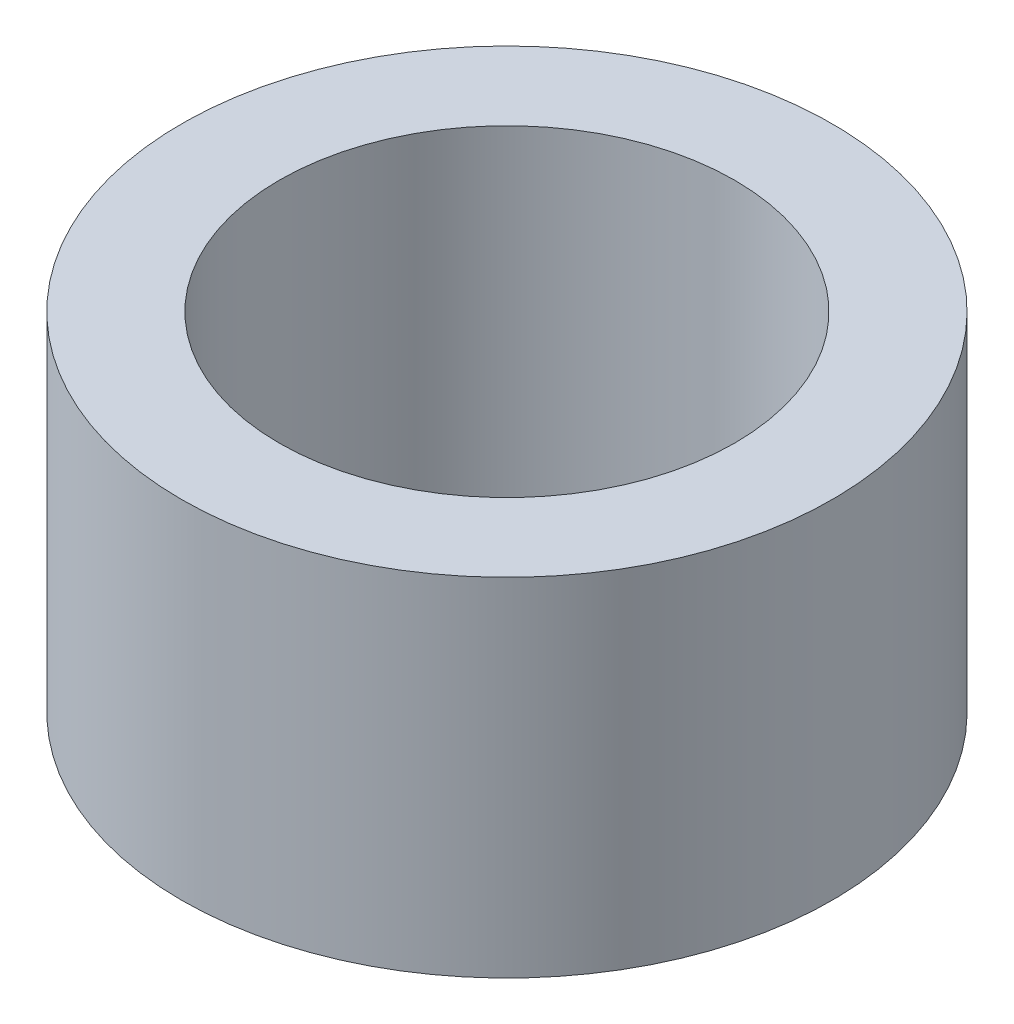
from build123d import *

# Parameters (mm, degrees)
SKETCH1_R           = 2.8575
SKETCH1_R_2         = 2
BOSS_EXTRUDE1_DEPTH = 3.048


with BuildPart() as part:
    # Sketch1 → Boss-Extrude1 (new body)
    with BuildSketch(Plane(origin=(0, 0, 0), x_dir=(1, 0, 0), z_dir=(0, 1, 0))):
        with Locations(Location((0, 0, 0), (0, 0, 270))):
            Circle(SKETCH1_R)
        with Locations(Location((0, 0, 0), (0, 0, 270))):
            Circle(SKETCH1_R_2, mode=Mode.SUBTRACT)
    extrude(amount=-BOSS_EXTRUDE1_DEPTH)


solid = part.part
